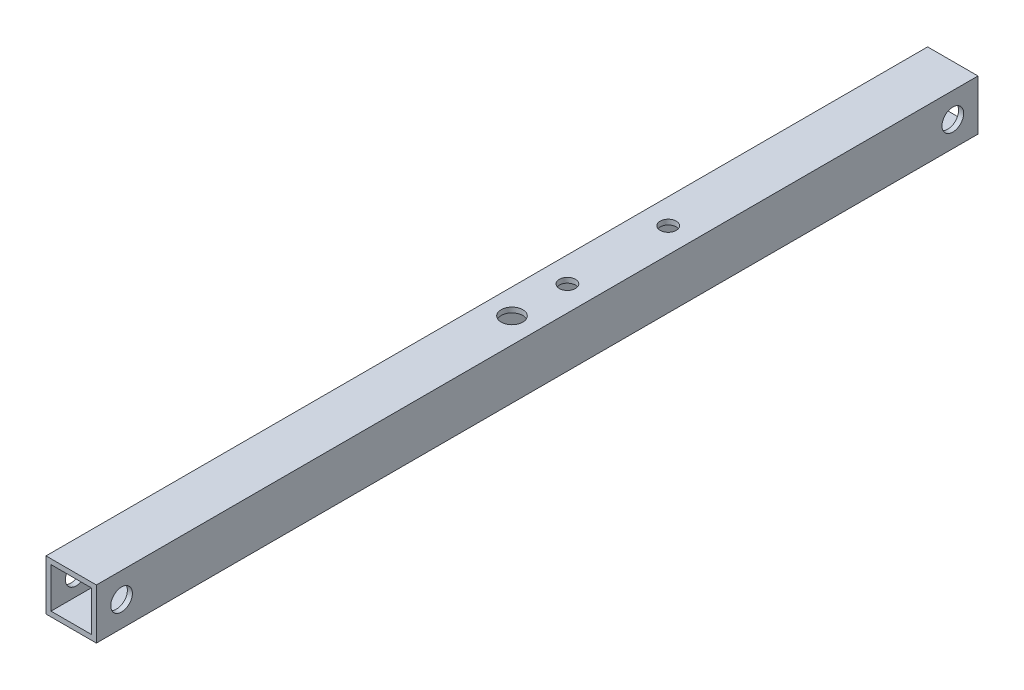
from build123d import *

# Parameters (mm, degrees)
SKETCH_1_W          = 10
SKETCH_1_H          = 10
SKETCH_1_W_2        = 8
SKETCH_1_H_2        = 8
EXTRUDE_1_DEPTH     = 175
SKETCH_2_R          = 2.15
CUT_EXTRUDE_1_DEPTH = 176.356779168
SKETCH_3_R          = 1.6
SKETCH_3_R_2        = 2.15
CUT_EXTRUDE_2_DEPTH = 176.356779168
SKETCH_4_R          = 4
CUT_EXTRUDE_3_DEPTH = 9


with BuildPart() as part:
    # ｽｹｯﾁ1 → 押し出し-薄板1 (new body)
    with BuildSketch(Plane.XY):
        Rectangle(SKETCH_1_W, SKETCH_1_H)
        Rectangle(SKETCH_1_W_2, SKETCH_1_H_2, mode=Mode.SUBTRACT)
    extrude(amount=EXTRUDE_1_DEPTH)

    # ｽｹｯﾁ2 → ｶｯﾄ - 押し出し1 (cut, through all)
    with BuildSketch(Plane(origin=(5, 0, 0), x_dir=(0, 0, -1), z_dir=(1, 0, 0))):
        with Locations(Location((-170, 0, 0), (0, 0, 90))):
            Circle(SKETCH_2_R)
        with Locations(Location((-5, 0, 0), (0, 0, 270))):
            Circle(SKETCH_2_R)
    extrude(amount=-CUT_EXTRUDE_1_DEPTH, mode=Mode.SUBTRACT)

    # ｽｹｯﾁ3 → ｶｯﾄ - 押し出し2 (cut, through all)
    with BuildSketch(Plane(origin=(0, 5, 0), x_dir=(1, 0, 0), z_dir=(0, 1, 0))):
        with Locations(Location((0, -76.5, 0), (0, 0, 180))):
            Circle(SKETCH_3_R)
        with Locations(Location((0, -56.5, 0), (0, 0, 180))):
            Circle(SKETCH_3_R)
        with Locations(Location((0, -87.5, 0), (0, 0, 180))):
            Circle(SKETCH_3_R_2)
    extrude(amount=-CUT_EXTRUDE_2_DEPTH, mode=Mode.SUBTRACT)

    # ｽｹｯﾁ4 → ｶｯﾄ - 押し出し3 (cut)
    with BuildSketch(Plane.XZ.offset(5)):
        with Locations((0, 87.5)):
            Circle(SKETCH_4_R)
    extrude(amount=-CUT_EXTRUDE_3_DEPTH, mode=Mode.SUBTRACT)


solid = part.part
